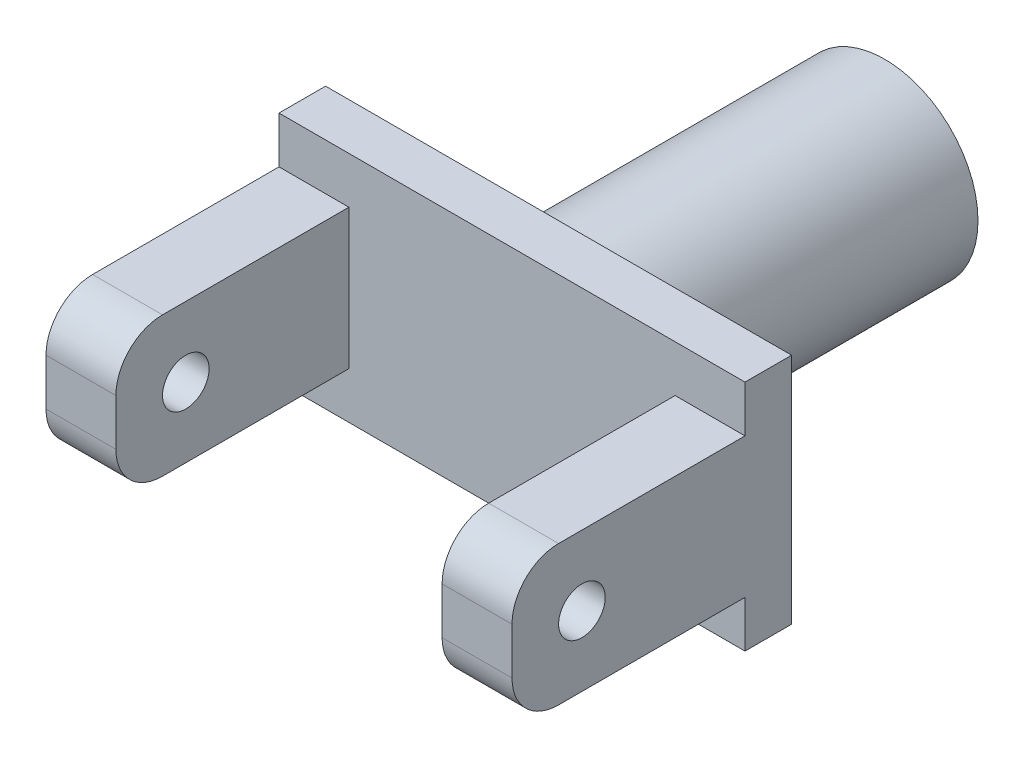
from build123d import *

# Parameters (mm, degrees)
SKETCH_1_R             = 20
SKETCH_1_R_2           = 15
EXTRUDE_1_DEPTH        = 70
SKETCH_2_W             = 100
SKETCH_2_H             = 50
EXTRUDE_2_DEPTH        = 10
SKETCH_3_W             = 15
SKETCH_3_H             = 30
EXTRUDE_3_DEPTH        = 50
FILLET_1_R             = 10
SKETCH_4_R             = 5
CUT_EXTRUDE_1_DEPTH    = 50
FILLET_1_OF_MIRROR_2_R = 10


with BuildPart() as part:
    # Эскиз1 → Бобышка-Вытянуть1 (new body)
    with BuildSketch(Plane.XY):
        Circle(SKETCH_1_R)
        Circle(SKETCH_1_R_2, mode=Mode.SUBTRACT)
    extrude(amount=EXTRUDE_1_DEPTH)

    # Эскиз2 → Бобышка-Вытянуть2 (add)
    with BuildSketch(Plane.XY.offset(70)):
        Rectangle(SKETCH_2_W, SKETCH_2_H)
    extrude(amount=EXTRUDE_2_DEPTH)

    # Эскиз3 → Бобышка-Вытянуть3 (add)
    with BuildSketch(Plane.XY.offset(80)):
        with Locations((-42.5, 0)):
            Rectangle(SKETCH_3_W, SKETCH_3_H)
    extrude_3 = extrude(amount=EXTRUDE_3_DEPTH)

    # Скругление1
    fillet_1_edges = [part.edges().sort_by_distance(p)[0] for p in [
        (-42.5, 15, 130),
        (-42.5, -15, 130),
    ]]
    fillet(fillet_1_edges, radius=FILLET_1_R)

    # Эскиз4 → Вырез-Вытянуть1 (cut)
    with BuildSketch(Plane.ZY.offset(50)):
        with Locations((115, 0)):
            Circle(SKETCH_4_R)
    cut_extrude_1 = extrude(amount=-CUT_EXTRUDE_1_DEPTH, mode=Mode.SUBTRACT)

    # Зеркальное отражение2: Бобышка-Вытянуть3, Вырез-Вытянуть1 across plane
    add(extrude_3.mirror(Plane(origin=(0, 0, 0), x_dir=(0, 0, 1), z_dir=(1, 0, 0))))
    add(cut_extrude_1.mirror(Plane(origin=(0, 0, 0), x_dir=(0, 0, 1), z_dir=(1, 0, 0))), mode=Mode.SUBTRACT)

    # Скругление1 of Зеркальное отражение2
    fillet_1_of_mirror_2_edges = [part.edges().sort_by_distance(p)[0] for p in [
        (42.5, 15, 130),
        (42.5, -15, 130),
    ]]
    fillet(fillet_1_of_mirror_2_edges, radius=FILLET_1_OF_MIRROR_2_R)


solid = part.part
